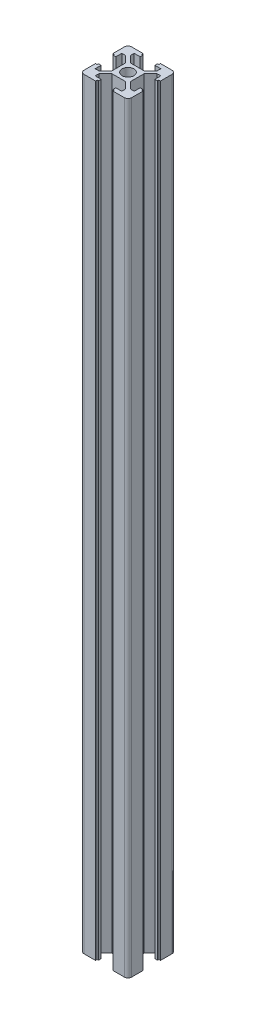
from build123d import *

# Parameters (mm, degrees)
SKETCH_1_R      = 2.5
EXTRUDE_1_DEPTH = 320
FILLET_1_R      = 1.5


with BuildPart() as part:
    # 草图1 → 凸台-拉伸1 (new body)
    with BuildSketch(Plane(origin=(0, 0, 0), x_dir=(1, 0, 0), z_dir=(0, 1, 0))):
        Polygon((10, 10), (3.65, 10), (3.65, 9.303257497), (3.1, 9.303257497), (3.1, 8.2), (5.6, 8.2), (5.6, 6.660660172), (2.839339828, 3.9), (-2.839339828, 3.9), (-5.6, 6.660660172), (-5.6, 8.2), (-3.1, 8.2), (-3.1, 9.303257497), (-3.65, 9.303257497), (-3.65, 10), (-10, 10), (-10, 3.65), (-9.303257497, 3.65), (-9.303257497, 3.1), (-8.2, 3.1), (-8.2, 5.6), (-6.660660172, 5.6), (-3.9, 2.839339828), (-3.9, -2.839339828), (-6.660660172, -5.6), (-8.2, -5.6), (-8.2, -3.1), (-9.303257497, -3.1), (-9.303257497, -3.65), (-10, -3.65), (-10, -10), (-3.65, -10), (-3.65, -9.303257497), (-3.1, -9.303257497), (-3.1, -8.2), (-5.6, -8.2), (-5.6, -6.660660172), (-2.839339828, -3.9), (2.839339828, -3.9), (5.6, -6.660660172), (5.6, -8.2), (3.1, -8.2), (3.1, -9.303257497), (3.65, -9.303257497), (3.65, -10), (10, -10), (10, -3.65), (9.303257497, -3.65), (9.303257497, -3.1), (8.2, -3.1), (8.2, -5.6), (6.660660172, -5.6), (3.9, -2.839339828), (3.9, 2.839339828), (6.660660172, 5.6), (8.2, 5.6), (8.2, 3.1), (9.303257497, 3.1), (9.303257497, 3.65), (10, 3.65), align=None)
        with Locations(Location((0, 0, 0), (0, 0, 270))):
            Circle(SKETCH_1_R, mode=Mode.SUBTRACT)
    extrude(amount=EXTRUDE_1_DEPTH)

    # 圆角1
    fillet_1_edges = [part.edges().sort_by_distance(p)[0] for p in [
        (10, 160, 10),
        (-10, 160, 10),
        (-10, 160, -10),
        (10, 160, -10),
    ]]
    fillet(fillet_1_edges, radius=FILLET_1_R)


solid = part.part
